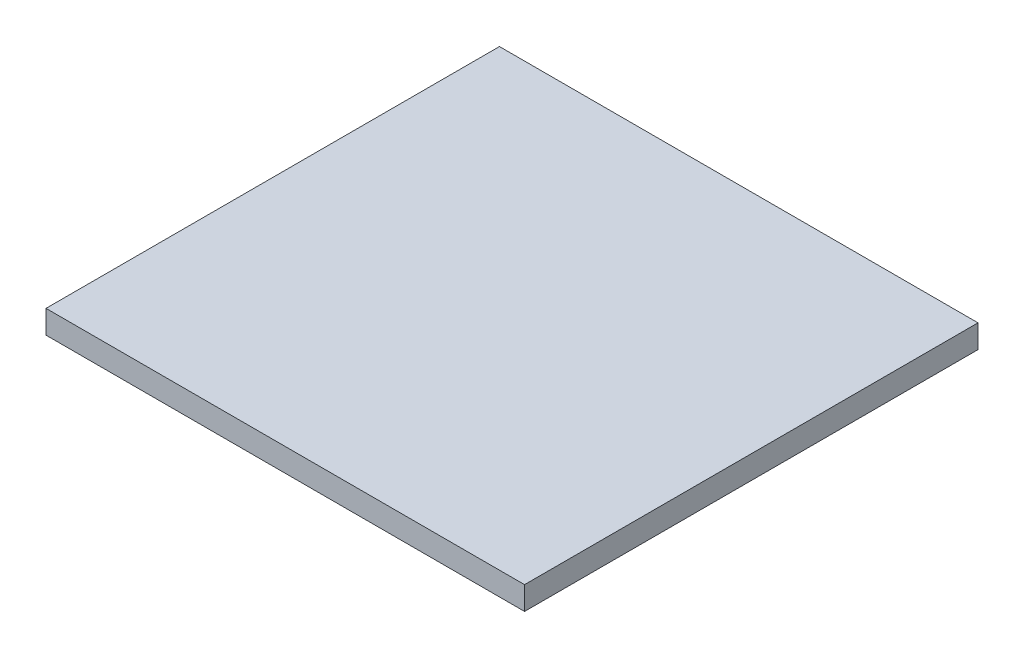
from build123d import *

# Parameters (mm, degrees)
SKETCH1_W           = 130.81
SKETCH1_H           = 123.952
BOSS_EXTRUDE1_DEPTH = 6.35


with BuildPart() as part:
    # Sketch1 → Boss-Extrude1 (new body)
    with BuildSketch(Plane(origin=(0, 0, 0), x_dir=(1, 0, 0), z_dir=(0, 1, 0))):
        with Locations((-0.540341615, 17.249913043)):
            Rectangle(SKETCH1_W, SKETCH1_H)
    extrude(amount=BOSS_EXTRUDE1_DEPTH)


solid = part.part
